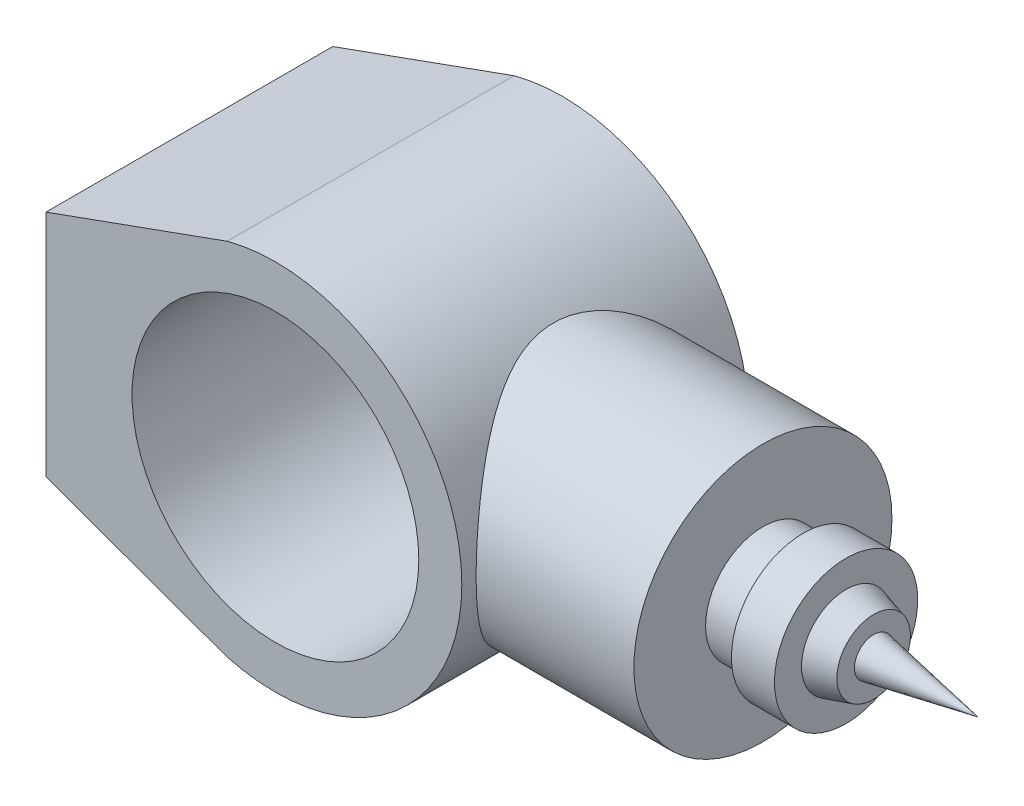
from build123d import *

# Parameters (mm, degrees)
SKETCH2_R                = 50
BOSS_EXTRUDE1_DEPTH      = 50
BOSS_EXTRUDE2_REACH      = 218.16
BOSS_EXTRUDE2_END_RADIUS = 65
SKETCH3_R                = 45


with BuildPart() as part:
    # Sketch2 → Boss-Extrude1 (new, symmetric)
    with BuildSketch(Plane.XY):
        with BuildLine():
            Line((-80, -40), (-80, 40))
            Line((-80, 40), (-16.774841978, 62.798126378))
            ThreePointArc((-16.774841978, 62.798126378), (65, 0), (-16.774841978, -62.798126378))
            Line((-16.774841978, -62.798126378), (-80, -40))
        make_face()
        Circle(SKETCH2_R, mode=Mode.SUBTRACT)
    extrude(amount=BOSS_EXTRUDE1_DEPTH, both=True)

    # Boss-Extrude2: up to this cylinder (the profile starts outside it)
    boss_extrude2_end = Plane(origin=(0, 0, 0), z_dir=(0, 0, -1)) * Cylinder(BOSS_EXTRUDE2_END_RADIUS, 567.32, mode=Mode.PRIVATE)
    # Sketch3 → Boss-Extrude2 (add, up to the surface)
    with BuildSketch(Plane(origin=(120, 0, 0), x_dir=(0, 0, -1), z_dir=(1, 0, 0)), mode=Mode.PRIVATE) as boss_extrude2_sk1:
        Circle(SKETCH3_R)
    boss_extrude2_tool1 = extrude(boss_extrude2_sk1.sketch, amount=-BOSS_EXTRUDE2_REACH, mode=Mode.PRIVATE) - boss_extrude2_end
    add(boss_extrude2_tool1.solids().sort_by_distance((120, 0, 0))[0])

    # Sketch4 → Revolve1 (revolve)
    with BuildSketch(Plane.XY, mode=Mode.PRIVATE) as revolve1_sk:
        Polygon((120, 0), (120, -20), (134, -20), (134, -25), (149, -25), (149, -15.555820326), (158.618526022, -12.820138114), (158.618526022, -6.737087738), (195, 0), align=None)
    revolve(revolve1_sk.sketch.rotate(Axis((0, 0, 0), (1, 0, 0)), 270), axis=Axis((0, 0, 0), (1, 0, 0)))


solid = part.part
